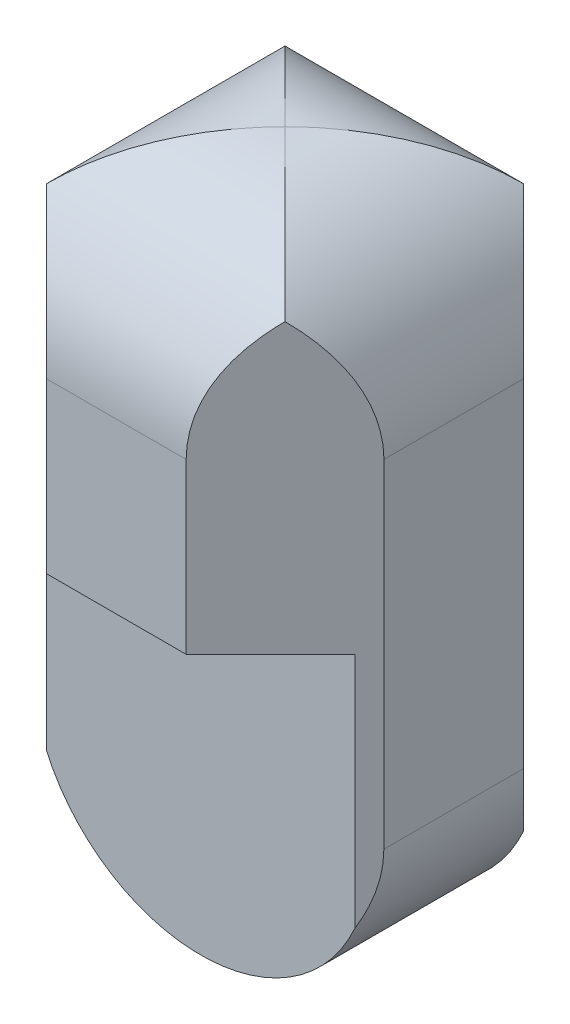
from build123d import *

# Parameters (mm, degrees)
EXTRUDE_1_DEPTH     = 44
CUT_EXTRUDE_1_DEPTH = 66
CUT_EXTRUDE_2_DEPTH = 5
CUT_EXTRUDE_START   = -5
CUT_EXTRUDE_3_DEPTH = 5
CUT_EXTRUDE_5_DEPTH = 30
CUT_EXTRUDE_6_DEPTH = 30


with BuildPart() as part:
    # 草图1 → 凸台-拉伸1 (new body)
    with BuildSketch(Plane(origin=(0, 0, 0), x_dir=(1, 0, 0), z_dir=(0, 1, 0))):
        Polygon((10, 4.142135624), (4.142135624, 10), (-4.142135624, 10), (-10, 4.142135624), (-10, -4.142135624), (-4.142135624, -10), (4.142135624, -10), (10, -4.142135624), align=None)
    extrude(amount=EXTRUDE_1_DEPTH)

    # 草图2 → 切除-拉伸1 (cut)
    with BuildSketch(Plane.XY.offset(10)):
        with BuildLine():
            Line((-10, 10), (-10, -2.389295552))
            Line((-10, -2.389295552), (10, -2.389295552))
            Line((10, -2.389295552), (10, 10))
            ThreePointArc((10, 10), (0, 0), (-10, 10))
        make_face()
    extrude(amount=-CUT_EXTRUDE_1_DEPTH, mode=Mode.SUBTRACT)

    # 草图4 → 切除-拉伸2 (cut)
    with BuildSketch(Plane.XY.offset(10)):
        with BuildLine():
            Line((-10, 10), (-10, 20))
            Line((-10, 20), (10, 20))
            Line((10, 20), (10, 10))
            ThreePointArc((10, 10), (0, 0), (-10, 10))
        make_face()
    extrude(amount=-CUT_EXTRUDE_2_DEPTH, mode=Mode.SUBTRACT)

    # 草图5 → 切除-拉伸3 (cut)
    with BuildSketch(Plane(origin=(0, 0, -10), x_dir=(-1, 0, 0), z_dir=(0, 0, -1)).offset(CUT_EXTRUDE_START)):
        with BuildLine():
            Line((-10, 10), (-10, 20))
            Line((-10, 20), (10, 20))
            Line((10, 20), (10, 10))
            ThreePointArc((10, 10), (0, 0), (-10, 10))
        make_face()
    extrude(amount=CUT_EXTRUDE_3_DEPTH, mode=Mode.SUBTRACT)

    # 草图7 → 切除-拉伸5 (cut)
    with BuildSketch(Plane.XY.offset(10)):
        with BuildLine():
            Line((-10, 30), (-10, 44.883881792))
            Line((-10, 44.883881792), (10, 44.883881792))
            Line((10, 44.883881792), (10, 30))
            ThreePointArc((10, 30), (0, 40), (-10, 30))
        make_face()
    extrude(amount=-CUT_EXTRUDE_5_DEPTH, mode=Mode.SUBTRACT)

    # 草图8 → 切除-拉伸6 (cut)
    with BuildSketch(Plane(origin=(10, 0, 0), x_dir=(0, 0, -1), z_dir=(1, 0, 0))):
        with BuildLine():
            Line((-10, 30), (-10, 44.07560735))
            Line((-10, 44.07560735), (10, 44.07560735))
            Line((10, 44.07560735), (10, 30))
            ThreePointArc((10, 30), (0, 40), (-10, 30))
        make_face()
    extrude(amount=-CUT_EXTRUDE_6_DEPTH, mode=Mode.SUBTRACT)


solid = part.part
